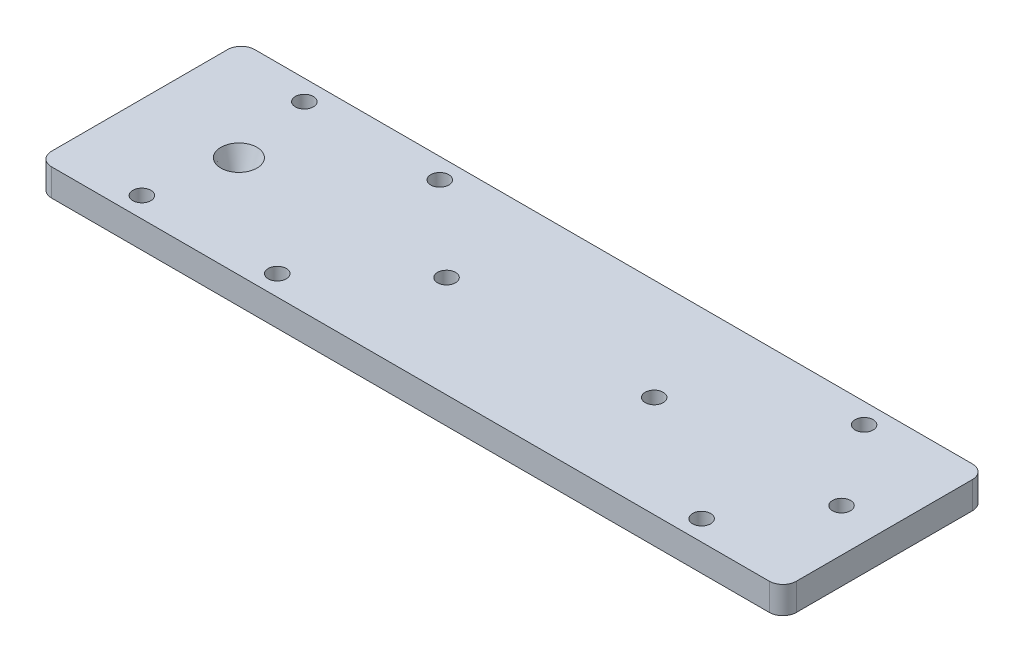
from build123d import *

# Parameters (mm, degrees)
SKETCH1_R           = 2
BOSS_EXTRUDE1_DEPTH = 3


with BuildPart() as part:
    # Sketch1 → Boss-Extrude1 (new, symmetric)
    with BuildSketch(Plane(origin=(0, 0, 0), x_dir=(1, 0, 0), z_dir=(0, 1, 0))):
        with BuildLine():
            Line((-79.5, 22.5), (79.5, 22.5))
            ThreePointArc((79.5, 22.5), (81.621320344, 21.621320344), (82.5, 19.5))
            Line((82.5, 19.5), (82.5, -19.5))
            ThreePointArc((82.5, -19.5), (81.621320344, -21.621320344), (79.5, -22.5))
            Line((79.5, -22.5), (-79.5, -22.5))
            ThreePointArc((-79.5, -22.5), (-81.621320344, -21.621320344), (-82.5, -19.5))
            Line((-82.5, -19.5), (-82.5, 19.5))
            ThreePointArc((-82.5, 19.5), (-81.621320344, 21.621320344), (-79.5, 22.5))
        make_face()
        with Locations(Location((-64, 18, 0), (0, 0, 270))):
            Circle(SKETCH1_R, mode=Mode.SUBTRACT)
        with Locations(Location((-34, 18, 0), (0, 0, 270))):
            Circle(SKETCH1_R, mode=Mode.SUBTRACT)
        with Locations(Location((60, 18, 0), (0, 0, 270))):
            Circle(SKETCH1_R, mode=Mode.SUBTRACT)
        with Locations(Location((-60.5, 0, 0), (0, 0, 270))):
            Circle(SKETCH1_R, mode=Mode.SUBTRACT)
        with Locations(Location((-14.5, 0, 0), (0, 0, 270))):
            Circle(SKETCH1_R, mode=Mode.SUBTRACT)
        with Locations(Location((31.5, 0, 0), (0, 0, 270))):
            Circle(SKETCH1_R, mode=Mode.SUBTRACT)
        with Locations(Location((73, 0, 0), (0, 0, 270))):
            Circle(SKETCH1_R, mode=Mode.SUBTRACT)
        with Locations(Location((60, -18, 0), (0, 0, 270))):
            Circle(SKETCH1_R, mode=Mode.SUBTRACT)
        with Locations(Location((-34, -18, 0), (0, 0, 270))):
            Circle(SKETCH1_R, mode=Mode.SUBTRACT)
        with Locations(Location((-64, -18, 0), (0, 0, 270))):
            Circle(SKETCH1_R, mode=Mode.SUBTRACT)
    extrude(amount=BOSS_EXTRUDE1_DEPTH, both=True)

    # Sketch7 → Cut-Revolve1 (revolve, cut)
    with BuildSketch(Plane.XY, mode=Mode.PRIVATE) as cut_revolve1_sk:
        Polygon((-58.5, -3), (-56.5, 3), (-58.5, 3), align=None)
    revolve(cut_revolve1_sk.sketch.rotate(Axis((-60.5, 0, 0), (0, -1, 0)), 180), axis=Axis((-60.5, 0, 0), (0, -1, 0)), mode=Mode.SUBTRACT)


solid = part.part
